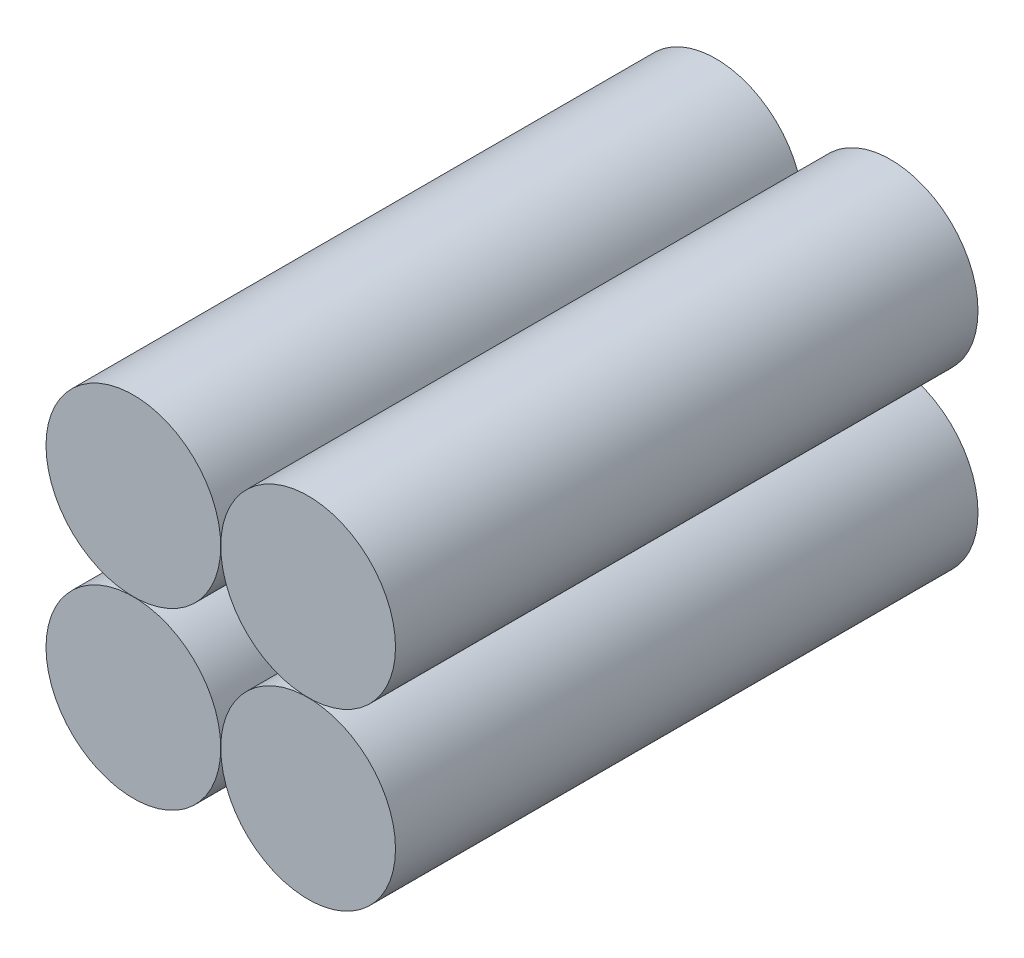
from build123d import *

# Parameters (mm, degrees)
SKETCH1_R             = 10.5
BOSS_EXTRUDE1_DEPTH   = 70
BOSS_EXTRUDE1_2_DEPTH = 70
BOSS_EXTRUDE1_3_DEPTH = 70
BOSS_EXTRUDE1_4_DEPTH = 70


with BuildPart() as part:
    # Sketch1 → Boss-Extrude1 (new body)
    with BuildSketch(Plane.XY):
        with Locations((-10.5, 10.5)):
            Circle(SKETCH1_R)
    extrude(amount=BOSS_EXTRUDE1_DEPTH)


with BuildPart() as body_2:
    # Sketch1 → Boss-Extrude1 2 (new body)
    with BuildSketch(Plane.XY):
        with Locations((10.5, 10.5)):
            Circle(SKETCH1_R)
    extrude(amount=BOSS_EXTRUDE1_2_DEPTH)


with BuildPart() as body_3:
    # Sketch1 → Boss-Extrude1 3 (new body)
    with BuildSketch(Plane.XY):
        with Locations((-10.5, -10.5)):
            Circle(SKETCH1_R)
    extrude(amount=BOSS_EXTRUDE1_3_DEPTH)


with BuildPart() as body_4:
    # Sketch1 → Boss-Extrude1 4 (new body)
    with BuildSketch(Plane.XY):
        with Locations((10.5, -10.5)):
            Circle(SKETCH1_R)
    extrude(amount=BOSS_EXTRUDE1_4_DEPTH)


solid = Compound([part.part, body_2.part, body_3.part, body_4.part])
